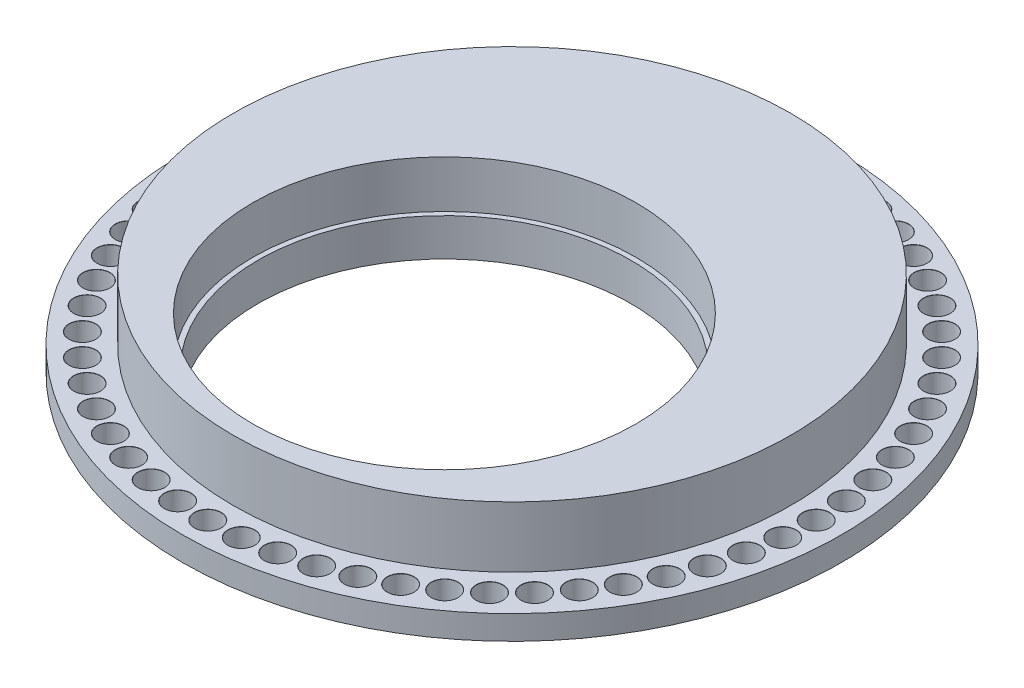
from build123d import *

# Parameters (mm, degrees)
SKETCH1_R                       = 61.9125
SKETCH1_R_2                     = 35.052
BOSS_EXTRUDE1_DEPTH             = 4.5212
SKETCH3_R                       = 52.3875
BOSS_EXTRUDE2_DEPTH             = 11.43
SKETCH4_R                       = 35.052
CUT_EXTRUDE1_DEPTH              = 89.998629731
SKETCH9_R                       = 36.000000009
CUT_EXTRUDE3_DEPTH              = 8.89
F_5_0MM_DOWEL_HOLE1_D           = 5
F_5_0MM_DOWEL_HOLE1_CSINK_D     = 5.05
F_5_0MM_DOWEL_HOLE1_CSINK_ANGLE = 90
CIRPATTERN1_COUNT               = 60


with BuildPart() as part:
    # Sketch1 → Boss-Extrude1 (new body)
    with BuildSketch(Plane(origin=(0, 0, 0), x_dir=(1, 0, 0), z_dir=(0, 1, 0))):
        with Locations(Location((0, 0, 0), (0, 0, 270))):
            Circle(SKETCH1_R)
        with Locations(Location((0, -12.7, 0), (0, 0, 270))):
            Circle(SKETCH1_R_2, mode=Mode.SUBTRACT)
    extrude(amount=BOSS_EXTRUDE1_DEPTH)

    # Sketch3 → Boss-Extrude2 (add)
    with BuildSketch(Plane(origin=(0, 4.5212, 0), x_dir=(1, 0, 0), z_dir=(0, 1, 0))):
        with Locations(Location((0, 0, 0), (0, 0, 270))):
            Circle(SKETCH3_R)
    extrude(amount=BOSS_EXTRUDE2_DEPTH)

    # Sketch4 → Cut-Extrude1 (cut, through all)
    with BuildSketch(Plane.XZ):
        with Locations(Location((0, 12.7, 0), (0, 0, 270))):
            Circle(SKETCH4_R)
    extrude(amount=-CUT_EXTRUDE1_DEPTH, mode=Mode.SUBTRACT)

    # Sketch9 → Cut-Extrude3 (cut)
    with BuildSketch(Plane(origin=(0, 15.9512, 0), x_dir=(1, 0, 0), z_dir=(0, 1, 0))):
        with Locations(Location((0, -12.7, 0), (0, 0, 270))):
            Circle(SKETCH9_R)
    extrude(amount=-CUT_EXTRUDE3_DEPTH, mode=Mode.SUBTRACT)

    # Ø5.0mm Dowel Hole1 (through all)
    with Locations(Plane(origin=(0, 4.5212, 0), x_dir=(1, 0, 0), z_dir=(0, 1, 0))):
        with Locations((0, 57.15)):
            f_5_0mm_dowel_hole1 = CounterSinkHole(F_5_0MM_DOWEL_HOLE1_D / 2, F_5_0MM_DOWEL_HOLE1_CSINK_D / 2, counter_sink_angle=F_5_0MM_DOWEL_HOLE1_CSINK_ANGLE)

    # CirPattern1: Ø5.0mm Dowel Hole1 ×60 about axis
    cirpattern1_axis = Axis((0, 0, 0), (0, 1, 0))
    for i in range(1, CIRPATTERN1_COUNT):
        add(f_5_0mm_dowel_hole1.rotate(cirpattern1_axis, i * 360 / CIRPATTERN1_COUNT), mode=Mode.SUBTRACT)


solid = part.part
